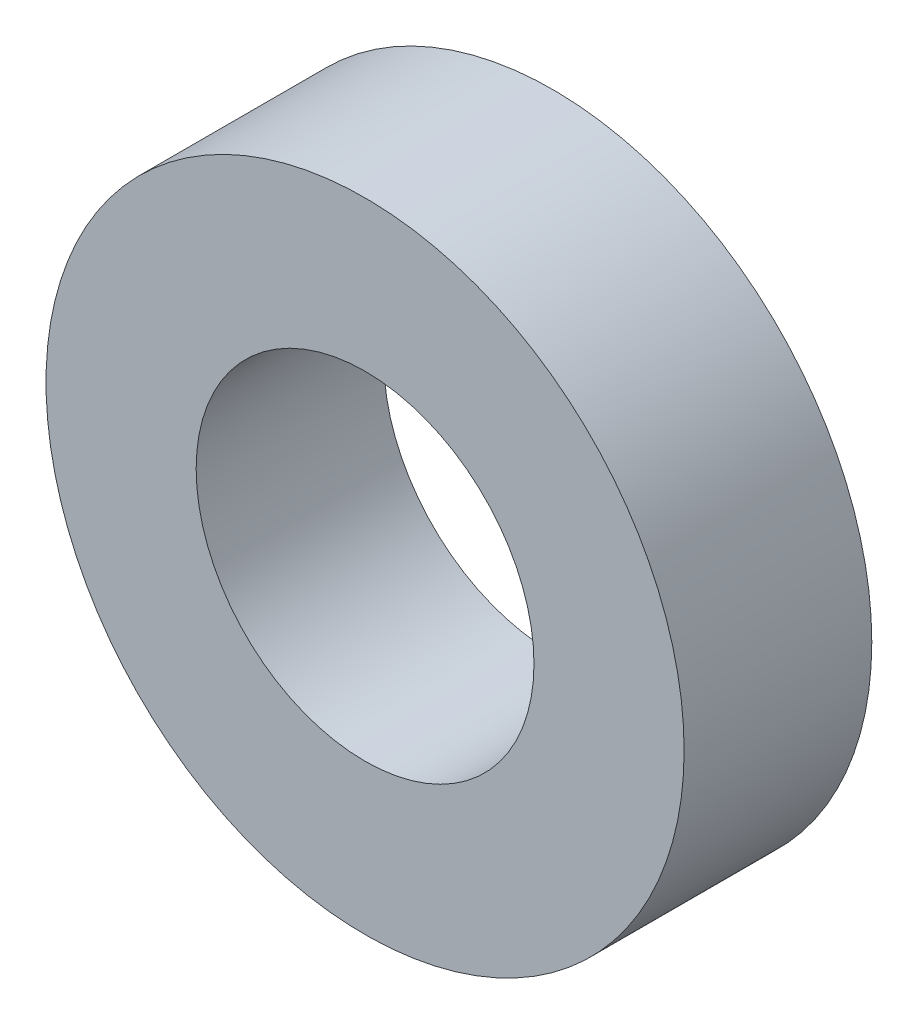
from build123d import *

# Parameters (mm, degrees)
SKETCH1_R           = 8.5
SKETCH1_R_2         = 4.5
BOSS_EXTRUDE1_DEPTH = 5


with BuildPart() as part:
    # Sketch1 → Boss-Extrude1 (new body)
    with BuildSketch(Plane.XY):
        Circle(SKETCH1_R)
        Circle(SKETCH1_R_2, mode=Mode.SUBTRACT)
    extrude(amount=BOSS_EXTRUDE1_DEPTH)


solid = part.part
